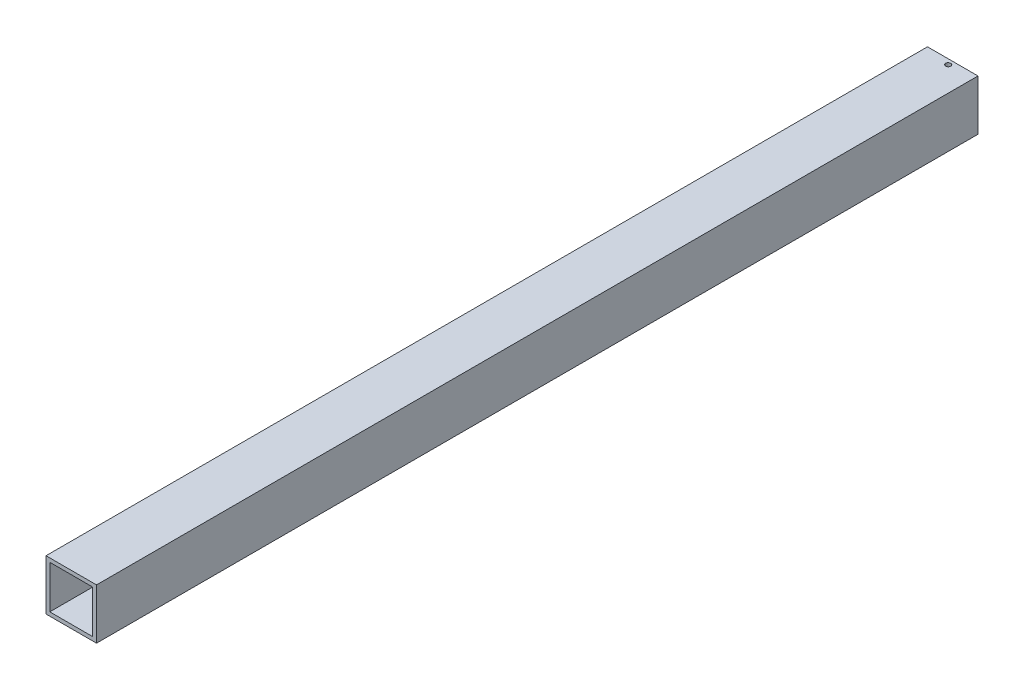
from build123d import *

# Parameters (mm, degrees)
SZKIC1_W                    = 20
SZKIC1_H                    = 20
SZKIC1_W_2                  = 17
SZKIC1_H_2                  = 17
DODANIE_WYCI_GNI_CIE1_DEPTH = 349
SZKIC3_R                    = 1
WYTNIJ_WYCI_GNI_CIE1_DEPTH  = 351.8939416


with BuildPart() as part:
    # Szkic1 → Dodanie-wyciągnięcie1 (new body)
    with BuildSketch(Plane.XY):
        with Locations((-20.422988866, 8.5)):
            Rectangle(SZKIC1_W, SZKIC1_H)
        with Locations((-20.422988866, 8.5)):
            Rectangle(SZKIC1_W_2, SZKIC1_H_2, mode=Mode.SUBTRACT)
    extrude(amount=DODANIE_WYCI_GNI_CIE1_DEPTH)

    # Szkic3 → Wytnij-wyciągnięcie1 (cut, through all)
    with BuildSketch(Plane(origin=(0, 18.5, 0), x_dir=(1, 0, 0), z_dir=(0, 1, 0))):
        with Locations(Location((-20.171616984, -2.046389983, 0), (0, 0, 180))):
            Circle(SZKIC3_R)
    extrude(amount=-WYTNIJ_WYCI_GNI_CIE1_DEPTH, mode=Mode.SUBTRACT)


solid = part.part
